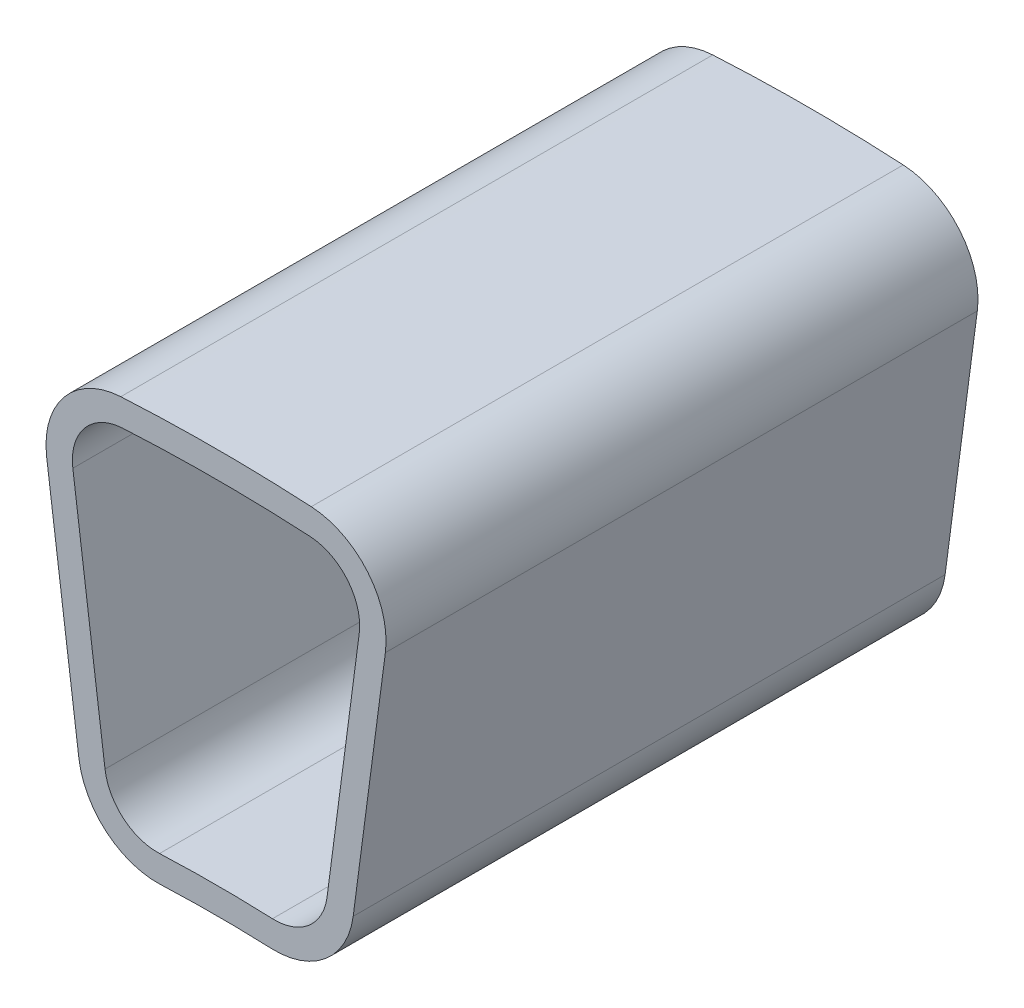
from build123d import *

# Parameters (mm, degrees)
BOSS_EXTRUDE1_DEPTH = 33.65


with BuildPart() as part:
    # Sketch1 → Boss-Extrude1 (new body)
    with BuildSketch(Plane.XY):
        with BuildLine():
            Line((7.797292276, 78.37955881), (9.626750626, 92.275674602))
            ThreePointArc((9.626750626, 92.275674602), (8.629643832, 95.734969819), (5.415162452, 97.356097457))
            ThreePointArc((5.415162452, 97.356097457), (0, 97.506582836), (-5.415162452, 97.356097457))
            ThreePointArc((-5.415162452, 97.356097457), (-8.629643832, 95.734969819), (-9.626750626, 92.275674602))
            Line((-9.626750626, 92.275674602), (-7.797292276, 78.37955881))
            ThreePointArc((-7.797292276, 78.37955881), (-6.230773591, 75.521774672), (-3.14586682, 74.470936347))
            ThreePointArc((-3.14586682, 74.470936347), (0, 74.537351968), (3.14586682, 74.470936347))
            ThreePointArc((3.14586682, 74.470936347), (6.230773591, 75.521774672), (7.797292276, 78.37955881))
        make_face()
        with BuildLine():
            Line((-8.139583334, 92.47146389), (-6.310124984, 78.575348099))
            ThreePointArc((-6.310124984, 78.575348099), (-5.265779194, 76.670158673), (-3.20917468, 75.96959979))
            ThreePointArc((-3.20917468, 75.96959979), (0, 76.037351968), (3.20917468, 75.96959979))
            ThreePointArc((3.20917468, 75.96959979), (5.265779194, 76.670158673), (6.310124984, 78.575348099))
            Line((6.310124984, 78.575348099), (8.139583334, 92.47146389))
            ThreePointArc((8.139583334, 92.47146389), (7.474845471, 94.777660702), (5.331857885, 95.85841246))
            ThreePointArc((5.331857885, 95.85841246), (0, 96.006582836), (-5.331857885, 95.85841246))
            ThreePointArc((-5.331857885, 95.85841246), (-7.474845471, 94.777660702), (-8.139583334, 92.47146389))
        make_face(mode=Mode.SUBTRACT)
    extrude(amount=BOSS_EXTRUDE1_DEPTH)


solid = part.part
